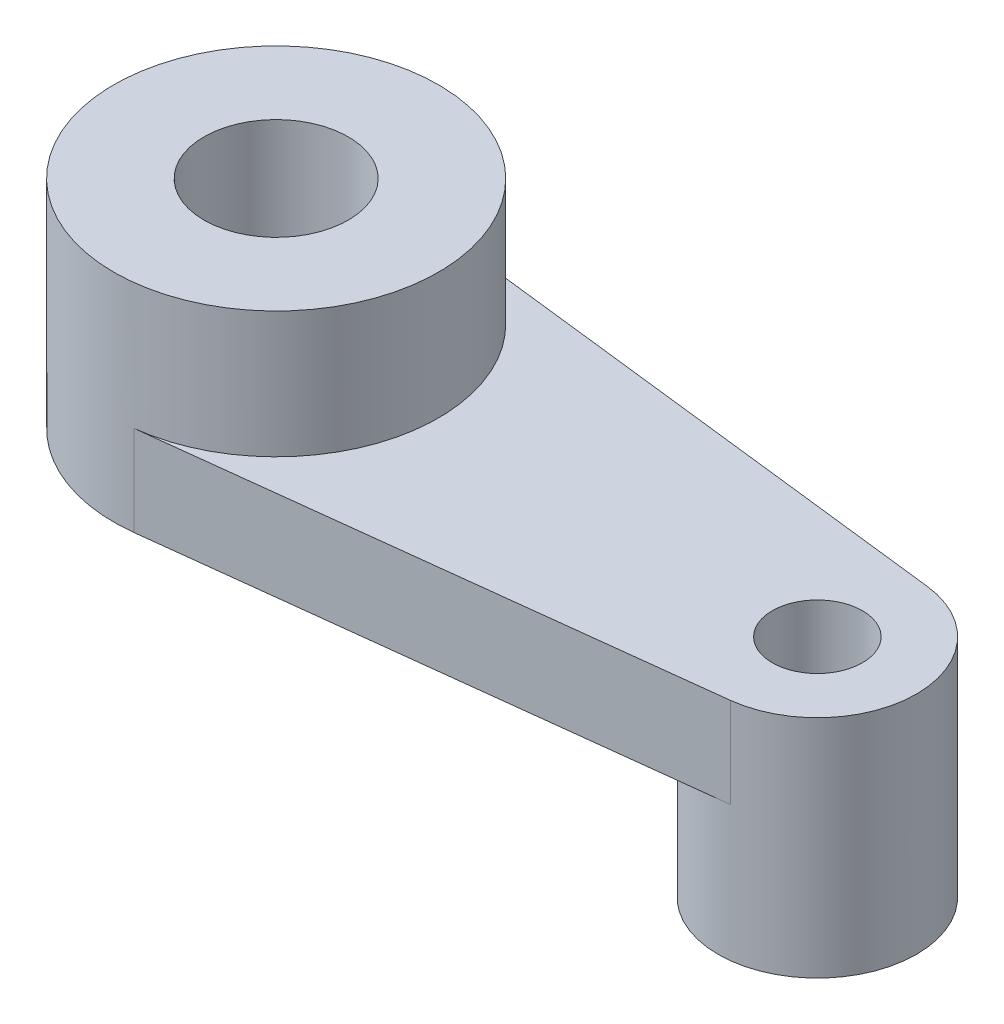
from build123d import *

# Parameters (mm, degrees)
SKETCH_1_R          = 18
EXTRUDE_1_DEPTH     = 24
EXTRUDE_2_DEPTH     = 10
EXTRUDE_START       = -15
SKETCH_3_R          = 11
EXTRUDE_3_DEPTH     = 15
SKETCH_4_R          = 8
CUT_EXTRUDE_1_DEPTH = 83.981925743
SKETCH_5_R          = 5
CUT_EXTRUDE_2_DEPTH = 83.981925743


with BuildPart() as part:
    # 草图1 → 凸台-拉伸1 (new body)
    with BuildSketch(Plane(origin=(0, 0, 0), x_dir=(1, 0, 0), z_dir=(0, 1, 0))):
        with Locations(Location((0, 0, 0), (0, 0, 270))):
            Circle(SKETCH_1_R)
    extrude(amount=EXTRUDE_1_DEPTH)

    # 草图2 → 凸台-拉伸2 (add)
    with BuildSketch(Plane(origin=(0, 0, 0), x_dir=(1, 0, 0), z_dir=(0, 1, 0))):
        with BuildLine():
            Line((2.1, 17.877080299), (61.283333333, 10.924882405))
            ThreePointArc((61.283333333, 10.924882405), (71, 0), (61.283333333, -10.924882405))
            Line((61.283333333, -10.924882405), (2.1, -17.877080299))
            ThreePointArc((2.1, -17.877080299), (-18, 0), (2.1, 17.877080299))
        make_face()
    extrude(amount=EXTRUDE_2_DEPTH)

    # 草图3 → 凸台-拉伸3 (add)
    with BuildSketch(Plane(origin=(0, 0, 0), x_dir=(1, 0, 0), z_dir=(0, 1, 0)).offset(EXTRUDE_START)):
        with Locations(Location((60, 0, 0), (0, 0, 83.300234822))):
            Circle(SKETCH_3_R)
    extrude(amount=EXTRUDE_3_DEPTH)

    # 草图4 → 切除-拉伸1 (cut, through all)
    with BuildSketch(Plane(origin=(0, 24, 0), x_dir=(1, 0, 0), z_dir=(0, 1, 0))):
        with Locations(Location((0, 0, 0), (0, 0, 270))):
            Circle(SKETCH_4_R)
    extrude(amount=-CUT_EXTRUDE_1_DEPTH, mode=Mode.SUBTRACT)

    # 草图5 → 切除-拉伸2 (cut, through all)
    with BuildSketch(Plane(origin=(0, -15, 0), x_dir=(1, 0, 0), z_dir=(0, 1, 0))):
        with Locations(Location((60, 0, 0), (0, 0, 90))):
            Circle(SKETCH_5_R)
    extrude(amount=CUT_EXTRUDE_2_DEPTH, mode=Mode.SUBTRACT)


solid = part.part
